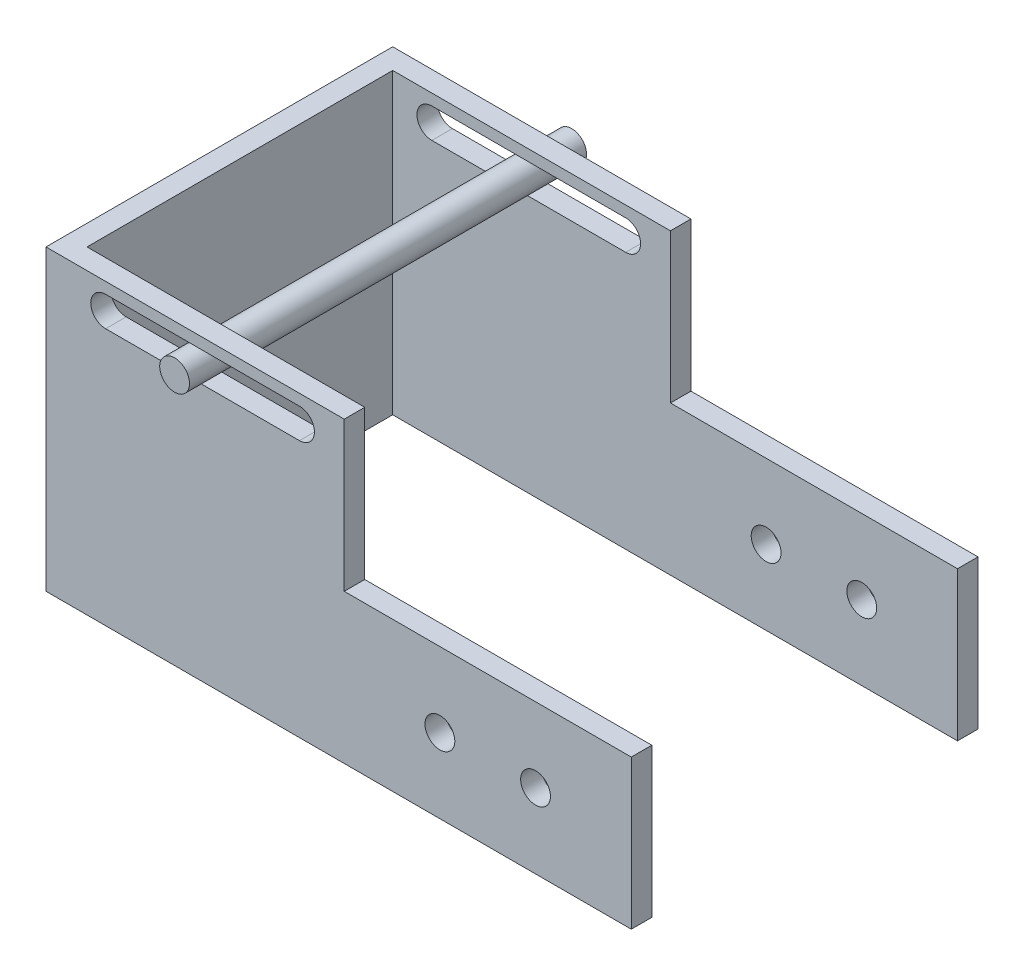
from build123d import *

# Parameters (mm, degrees)
SKETCH1_R           = 2
BOSS_EXTRUDE1_DEPTH = 2.75
BOSS_EXTRUDE2_START = -4
SKETCH1_4_R         = 2
BOSS_EXTRUDE2_DEPTH = 53.25
SKETCH2_W           = 2.75
SKETCH2_H           = 40
BOSS_EXTRUDE3_DEPTH = 43.75
LPATTERN1_COUNT     = 2
LPATTERN1_PITCH     = 43.75


with BuildPart() as part:
    # Sketch1 → Boss-Extrude1 (new body)
    with BuildSketch(Plane.XY):
        Polygon((38.5, 0), (0, 0), (0, 20), (-40, 20), (-40, -20), (38.5, -20), align=None)
        with Locations((12.83, -10)):
            Circle(SKETCH1_R, mode=Mode.SUBTRACT)
        with Locations((25.66, -10)):
            Circle(SKETCH1_R, mode=Mode.SUBTRACT)
        with BuildLine():
            ThreePointArc((-32, 14.5), (-34, 16.5), (-32, 18.5))
            Line((-32, 18.5), (-20, 18.5))
            Line((-20, 18.5), (-6, 18.5))
            ThreePointArc((-6, 18.5), (-4, 16.5), (-6, 14.5))
            Line((-6, 14.5), (-20, 14.5))
            Line((-20, 14.5), (-32, 14.5))
        make_face(mode=Mode.SUBTRACT)
    boss_extrude1 = extrude(amount=BOSS_EXTRUDE1_DEPTH)

    # Sketch2 → Boss-Extrude3 (add)
    with BuildSketch(Plane.XY.offset(2.75)):
        with Locations((-38.625, 0)):
            Rectangle(SKETCH2_W, SKETCH2_H)
    extrude(amount=BOSS_EXTRUDE3_DEPTH)

    # LPattern1: Boss-Extrude1 ×2
    with Locations(*[(0, 0, i * LPATTERN1_PITCH) for i in range(1, LPATTERN1_COUNT)]):
        add(boss_extrude1)


with BuildPart() as body_2:
    # Sketch1<4> → Boss-Extrude2 (new body)
    with BuildSketch(Plane.XY.offset(BOSS_EXTRUDE2_START)):
        with Locations((-20, 16.5)):
            Circle(SKETCH1_4_R)
    extrude(amount=BOSS_EXTRUDE2_DEPTH)


solid = Compound([part.part, body_2.part])
